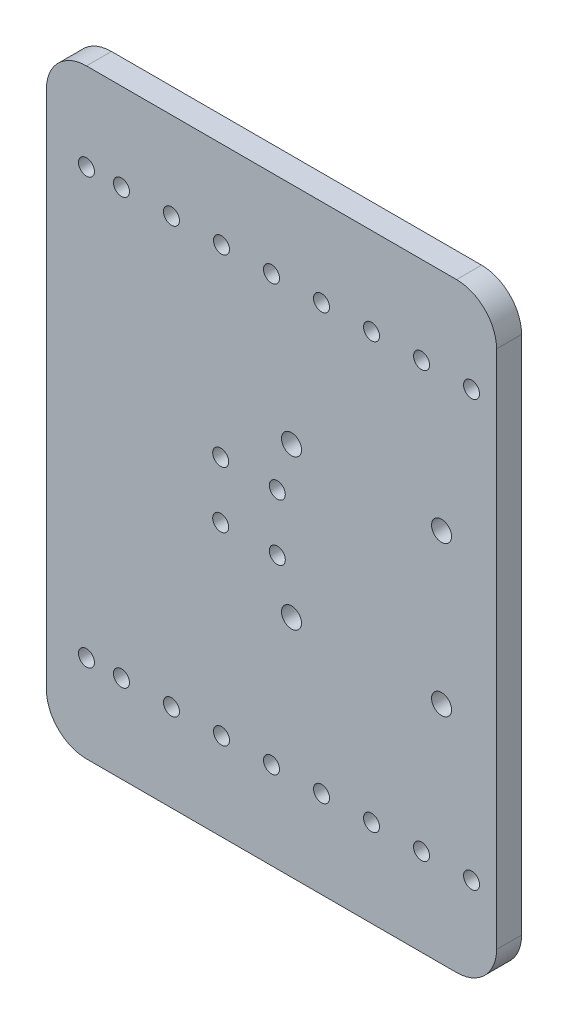
from build123d import *

# Parameters (mm, degrees)
SKETCH_1_W            = 90
SKETCH_1_H            = 120
SKETCH_1_R            = 2
SKETCH_1_R_2          = 1.6
EXTRUDE_1_DEPTH       = 5
FILLET_1_R            = 8
F_3_2_PCD16_R         = 1.6
CUT_EXTRUDE_3_2_DEPTH = 10
F_6_PCD16_R           = 3
CUT_EXTRUDE_6_1_DEPTH = 1


with BuildPart() as part:
    # 草图1 → 凸台-拉伸1 (new body)
    with BuildSketch(Plane.XY):
        with Locations((45, -60)):
            Rectangle(SKETCH_1_W, SKETCH_1_H)
        with Locations((79, -45)):
            Circle(SKETCH_1_R, mode=Mode.SUBTRACT)
        with Locations((79, -75)):
            Circle(SKETCH_1_R, mode=Mode.SUBTRACT)
        with Locations((49, -45)):
            Circle(SKETCH_1_R, mode=Mode.SUBTRACT)
        with Locations((49, -75)):
            Circle(SKETCH_1_R, mode=Mode.SUBTRACT)
        with Locations((85, -102.5)):
            Circle(SKETCH_1_R_2, mode=Mode.SUBTRACT)
        with Locations((75, -102.5)):
            Circle(SKETCH_1_R_2, mode=Mode.SUBTRACT)
        with Locations((65, -102.5)):
            Circle(SKETCH_1_R_2, mode=Mode.SUBTRACT)
        with Locations((55, -102.5)):
            Circle(SKETCH_1_R_2, mode=Mode.SUBTRACT)
        with Locations((45, -102.5)):
            Circle(SKETCH_1_R_2, mode=Mode.SUBTRACT)
        with Locations((85, -17.5)):
            Circle(SKETCH_1_R_2, mode=Mode.SUBTRACT)
        with Locations((75, -17.5)):
            Circle(SKETCH_1_R_2, mode=Mode.SUBTRACT)
        with Locations((65, -17.5)):
            Circle(SKETCH_1_R_2, mode=Mode.SUBTRACT)
        with Locations((55, -17.5)):
            Circle(SKETCH_1_R_2, mode=Mode.SUBTRACT)
        with Locations((45, -17.5)):
            Circle(SKETCH_1_R_2, mode=Mode.SUBTRACT)
        with Locations((35, -102.5)):
            Circle(SKETCH_1_R_2, mode=Mode.SUBTRACT)
        with Locations((25, -102.5)):
            Circle(SKETCH_1_R_2, mode=Mode.SUBTRACT)
        with Locations((15, -102.5)):
            Circle(SKETCH_1_R_2, mode=Mode.SUBTRACT)
        with Locations((35, -17.5)):
            Circle(SKETCH_1_R_2, mode=Mode.SUBTRACT)
        with Locations((25, -17.5)):
            Circle(SKETCH_1_R_2, mode=Mode.SUBTRACT)
        with Locations((15, -17.5)):
            Circle(SKETCH_1_R_2, mode=Mode.SUBTRACT)
        with Locations((8, -102.5)):
            Circle(SKETCH_1_R_2, mode=Mode.SUBTRACT)
        with Locations((8, -17.5)):
            Circle(SKETCH_1_R_2, mode=Mode.SUBTRACT)
    extrude(amount=EXTRUDE_1_DEPTH)

    # 圆角1
    fillet_1_edges = [part.edges().sort_by_distance(p)[0] for p in [
        (0, 0, 2.5),
        (90, 0, 2.5),
        (90, -120, 2.5),
        (0, -120, 2.5),
    ]]
    fillet(fillet_1_edges, radius=FILLET_1_R)

    # 内圈四孔_Ø3.2_PCD16 → 内圈四孔_通孔_Ø3.2 (cut)
    with BuildSketch(Plane(origin=(0, 0, 0), x_dir=(-1, 0, 0), z_dir=(0, 0, -1))):
        with Locations((-46.156854249, -54.343145751)):
            Circle(F_3_2_PCD16_R)
        with Locations((-34.843145751, -54.343145751)):
            Circle(F_3_2_PCD16_R)
        with Locations((-34.843145751, -65.656854249)):
            Circle(F_3_2_PCD16_R)
        with Locations((-46.156854249, -65.656854249)):
            Circle(F_3_2_PCD16_R)
    extrude(amount=-CUT_EXTRUDE_3_2_DEPTH, mode=Mode.SUBTRACT)

    # 内圈沉孔_Ø6_PCD16 → 内圈四孔_沉孔_Ø6深1 (cut)
    with BuildSketch(Plane(origin=(0, 0, 0), x_dir=(-1, 0, 0), z_dir=(0, 0, -1))):
        with Locations((-46.156854249, -54.343145751)):
            Circle(F_6_PCD16_R)
        with Locations((-34.843145751, -54.343145751)):
            Circle(F_6_PCD16_R)
        with Locations((-34.843145751, -65.656854249)):
            Circle(F_6_PCD16_R)
        with Locations((-46.156854249, -65.656854249)):
            Circle(F_6_PCD16_R)
    extrude(amount=-CUT_EXTRUDE_6_1_DEPTH, mode=Mode.SUBTRACT)


solid = part.part
